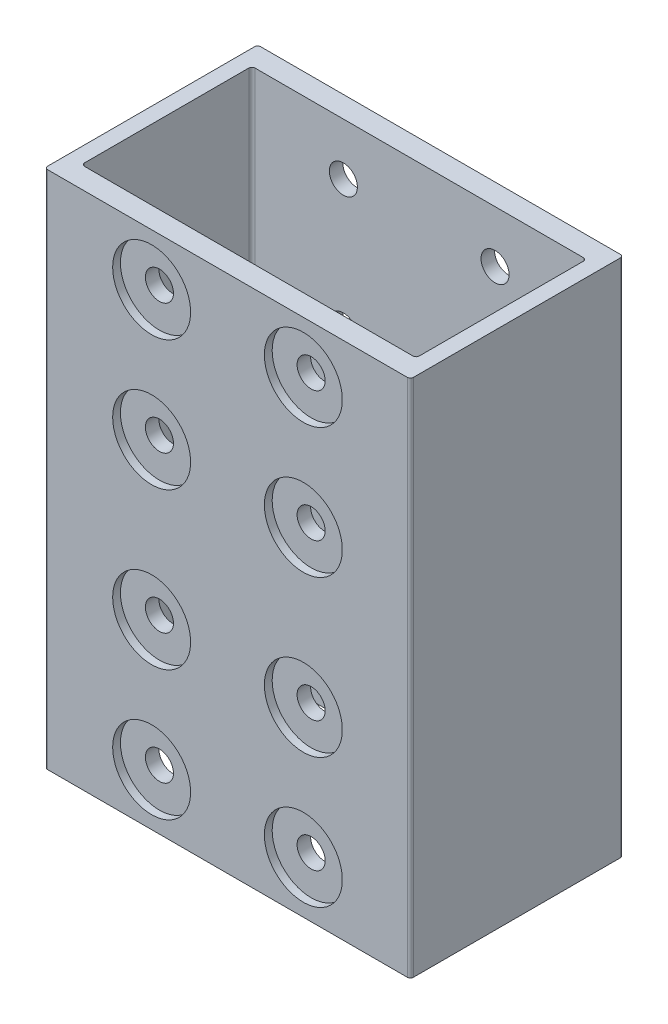
from build123d import *

# Parameters (mm, degrees)
SKETCH1_W               = 89.408
SKETCH1_H               = 48.26
SKETCH1_W_2             = 81.788
SKETCH1_H_2             = 41.656
BOSS_EXTRUDE1_DEPTH     = 127
CUT_EXTRUDE1_DEPTH      = 137.783421934
CUT_EXTRUDE1_DEPTH_BACK = 137.783421934
SKETCH3_R               = 3.429
SKETCH5_W               = 89.408
SKETCH5_H               = 127
SKETCH5_R               = 9.525
BOSS_EXTRUDE3_DEPTH     = 1.905
FILLET1_R               = 0.762


with BuildPart() as part:
    # Sketch1 → Boss-Extrude1 (new body)
    with BuildSketch(Plane(origin=(0, 0, 0), x_dir=(1, 0, 0), z_dir=(0, 1, 0))):
        Rectangle(SKETCH1_W, SKETCH1_H)
        Rectangle(SKETCH1_W_2, SKETCH1_H_2, mode=Mode.SUBTRACT)
    extrude(amount=BOSS_EXTRUDE1_DEPTH)

    # Sketch3 → Cut-Extrude1 (cut, two sides: drawn at the far end of the back side and taken through both)
    with BuildSketch(Plane.XY.offset(-CUT_EXTRUDE1_DEPTH_BACK)):
        with Locations((-18.542, 114.3)):
            Circle(SKETCH3_R)
        with Locations((-18.542, 82.55)):
            Circle(SKETCH3_R)
        with Locations(Location((18.542, 82.55, 0), (0, 0, 180))):
            Circle(SKETCH3_R)
        with Locations(Location((18.542, 114.3, 0), (0, 0, 180))):
            Circle(SKETCH3_R)
        with Locations((18.542, 12.7)):
            Circle(SKETCH3_R)
        with Locations((18.542, 44.45)):
            Circle(SKETCH3_R)
        with Locations(Location((-18.542, 44.45, 0), (0, 0, 180))):
            Circle(SKETCH3_R)
        with Locations(Location((-18.542, 12.7, 0), (0, 0, 180))):
            Circle(SKETCH3_R)
    extrude(amount=CUT_EXTRUDE1_DEPTH + CUT_EXTRUDE1_DEPTH_BACK, mode=Mode.SUBTRACT)

    # Sketch5 → Boss-Extrude3 (add)
    with BuildSketch(Plane(origin=(0, 0, -24.13), x_dir=(-1, 0, 0), z_dir=(0, 0, -1))):
        with Locations((0, 63.5)):
            Rectangle(SKETCH5_W, SKETCH5_H)
        with Locations(Location((18.542, 12.7, 0), (0, 0, 180))):
            Circle(SKETCH5_R, mode=Mode.SUBTRACT)
        with Locations(Location((-18.542, 12.7, 0), (0, 0, 180))):
            Circle(SKETCH5_R, mode=Mode.SUBTRACT)
        with Locations(Location((-18.542, 44.45, 0), (0, 0, 180))):
            Circle(SKETCH5_R, mode=Mode.SUBTRACT)
        with Locations(Location((18.542, 44.45, 0), (0, 0, 180))):
            Circle(SKETCH5_R, mode=Mode.SUBTRACT)
        with Locations(Location((18.542, 82.55, 0), (0, 0, 180))):
            Circle(SKETCH5_R, mode=Mode.SUBTRACT)
        with Locations(Location((-18.542, 82.55, 0), (0, 0, 180))):
            Circle(SKETCH5_R, mode=Mode.SUBTRACT)
        with Locations(Location((18.542, 114.3, 0), (0, 0, 180))):
            Circle(SKETCH5_R, mode=Mode.SUBTRACT)
        with Locations(Location((-18.542, 114.3, 0), (0, 0, 180))):
            Circle(SKETCH5_R, mode=Mode.SUBTRACT)
    boss_extrude3 = extrude(amount=BOSS_EXTRUDE3_DEPTH)

    # Mirror3: Boss-Extrude3 across plane
    add(boss_extrude3.mirror(Plane.XY))

    # Fillet1
    fillet1_edges = [part.edges().sort_by_distance(p)[0] for p in [
        (44.704, 63.5, -26.035),
        (-44.704, 63.5, -26.035),
        (44.704, 63.5, 26.035),
        (-44.704, 63.5, 26.035),
        (40.894, 63.5, 20.828),
        (40.894, 63.5, -20.828),
        (-40.894, 63.5, -20.828),
        (-40.894, 63.5, 20.828),
    ]]
    fillet(fillet1_edges, radius=FILLET1_R)


solid = part.part
